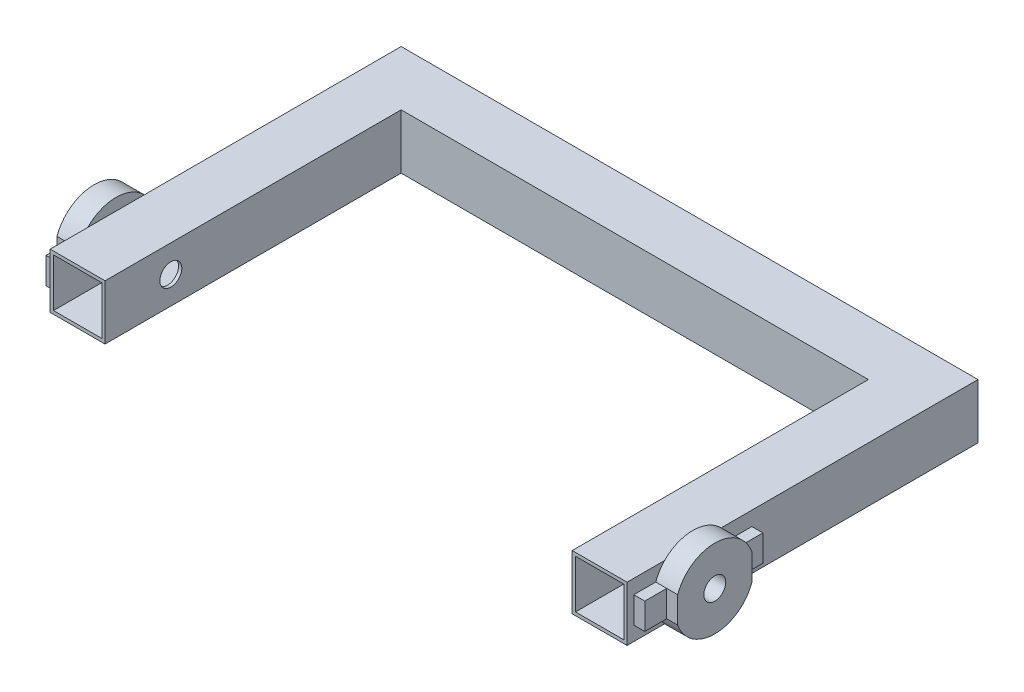
from build123d import *

# Parameters (mm, degrees)
SKETCH3_W           = 25
SKETCH3_H           = 25
SKETCH3_W_2         = 22
SKETCH3_H_2         = 22
BOSS_EXTRUDE1_DEPTH = 160
SKETCH4_W           = 25
SKETCH4_H           = 25
SKETCH4_W_2         = 22
SKETCH4_H_2         = 22
BOSS_EXTRUDE2_DEPTH = 106.5
SKETCH5_R           = 5
BOSS_EXTRUDE3_DEPTH = 10
SKETCH6_W           = 10
SKETCH6_H           = 12
CUT_EXTRUDE1_DEPTH  = 5
CUT_EXTRUDE2_START  = -25
SKETCH7_R           = 5
CUT_EXTRUDE2_DEPTH  = 25


with BuildPart() as part:
    # Sketch3 → Boss-Extrude1 (new body)
    with BuildSketch(Plane.XY):
        with Locations((-35.404260395, 0)):
            Rectangle(SKETCH3_W, SKETCH3_H)
        with Locations((-35.404260395, 0)):
            Rectangle(SKETCH3_W_2, SKETCH3_H_2, mode=Mode.SUBTRACT)
    boss_extrude1 = extrude(amount=BOSS_EXTRUDE1_DEPTH)

    # Sketch4 → Boss-Extrude2 (add)
    with BuildSketch(Plane(origin=(-22.904260395, 0, 0), x_dir=(0, 0, -1), z_dir=(1, 0, 0))):
        with Locations((-12.5, 0)):
            Rectangle(SKETCH4_W, SKETCH4_H)
        with Locations((-12.5, 0)):
            Rectangle(SKETCH4_W_2, SKETCH4_H_2, mode=Mode.SUBTRACT)
    boss_extrude2 = extrude(amount=BOSS_EXTRUDE2_DEPTH)

    # Sketch5 → Boss-Extrude3 (add)
    # profile 1 of 5: a face of its own
    with BuildSketch(Plane.ZY.offset(47.904260395)):
        with BuildLine():
            ThreePointArc((113.082291583, -6), (112.049822896, 0), (113.082291583, 6))
            Line((113.082291583, 6), (103.082291583, 6))
            Line((103.082291583, 6), (103.082291583, -6))
            Line((103.082291583, -6), (113.082291583, -6))
        make_face()
    # profile 2 of 5: a face of its own
    with BuildSketch(Plane.ZY.offset(47.904260395)):
        with BuildLine():
            ThreePointArc((147.950177104, 0), (147.69017694, 3.044092295), (146.917708417, 6))
            ThreePointArc((146.917708417, 6), (145.250430663, 9.467482384), (142.882502012, 12.5))
            Line((142.882502012, 12.5), (117.117497988, 12.5))
            ThreePointArc((117.117497988, 12.5), (114.749569337, 9.467482384), (113.082291583, 6))
            ThreePointArc((113.082291583, 6), (112.049822896, 0), (113.082291583, -6))
            ThreePointArc((113.082291583, -6), (114.749569337, -9.467482384), (117.117497988, -12.5))
            Line((117.117497988, -12.5), (142.882502012, -12.5))
            ThreePointArc((142.882502012, -12.5), (145.250430663, -9.467482384), (146.917708417, -6))
            ThreePointArc((146.917708417, -6), (147.69017694, -3.044092295), (147.950177104, 0))
        make_face()
        with Locations((130, 0)):
            Circle(SKETCH5_R, mode=Mode.SUBTRACT)
    # profile 3 of 5: a face of its own
    with BuildSketch(Plane.ZY.offset(47.904260395)):
        with BuildLine():
            Line((156.917708417, 6), (146.917708417, 6))
            ThreePointArc((146.917708417, 6), (147.69017694, 3.044092295), (147.950177104, 0))
            ThreePointArc((147.950177104, 0), (147.69017694, -3.044092295), (146.917708417, -6))
            Line((146.917708417, -6), (156.917708417, -6))
            Line((156.917708417, -6), (156.917708417, 6))
        make_face()
    # profile 4 of 5: a face of its own
    with BuildSketch(Plane.ZY.offset(47.904260395)):
        with BuildLine():
            Line((117.117497988, 12.5), (142.882502012, 12.5))
            ThreePointArc((142.882502012, 12.5), (130, 17.950177104), (117.117497988, 12.5))
        make_face()
    # profile 5 of 5: a face of its own
    with BuildSketch(Plane.ZY.offset(47.904260395)):
        with BuildLine():
            ThreePointArc((117.117497988, -12.5), (130, -17.950177104), (142.882502012, -12.5))
            Line((142.882502012, -12.5), (117.117497988, -12.5))
        make_face()
    boss_extrude3 = extrude(amount=BOSS_EXTRUDE3_DEPTH)

    # Sketch6 → Cut-Extrude1 (cut)
    with BuildSketch(Plane.ZY.offset(57.904260395)):
        with Locations((108.082291583, 0)):
            Rectangle(SKETCH6_W, SKETCH6_H)
        with Locations((151.917708417, 0)):
            Rectangle(SKETCH6_W, SKETCH6_H)
    cut_extrude1 = extrude(amount=-CUT_EXTRUDE1_DEPTH, mode=Mode.SUBTRACT)

    # Sketch7 → Cut-Extrude2 (cut)
    with BuildSketch(Plane.ZY.offset(47.904260395).offset(CUT_EXTRUDE2_START)):
        with Locations(Location((130, 0, 0), (0, 0, 180))):
            Circle(SKETCH7_R)
    cut_extrude2 = extrude(amount=CUT_EXTRUDE2_DEPTH, mode=Mode.SUBTRACT)

    # Mirror1: Boss-Extrude1, Boss-Extrude2, Boss-Extrude3, Cut-Extrude1, Cut-Extrude2 across plane
    add(boss_extrude1.mirror(Plane(origin=(83.595739605, 0, 0), x_dir=(0, 0, 1), z_dir=(1, 0, 0))))
    add(boss_extrude2.mirror(Plane(origin=(83.595739605, 0, 0), x_dir=(0, 0, 1), z_dir=(1, 0, 0))))
    add(boss_extrude3.mirror(Plane(origin=(83.595739605, 0, 0), x_dir=(0, 0, 1), z_dir=(1, 0, 0))))
    add(cut_extrude1.mirror(Plane(origin=(83.595739605, 0, 0), x_dir=(0, 0, 1), z_dir=(1, 0, 0))), mode=Mode.SUBTRACT)
    add(cut_extrude2.mirror(Plane(origin=(83.595739605, 0, 0), x_dir=(0, 0, 1), z_dir=(1, 0, 0))), mode=Mode.SUBTRACT)


solid = part.part
